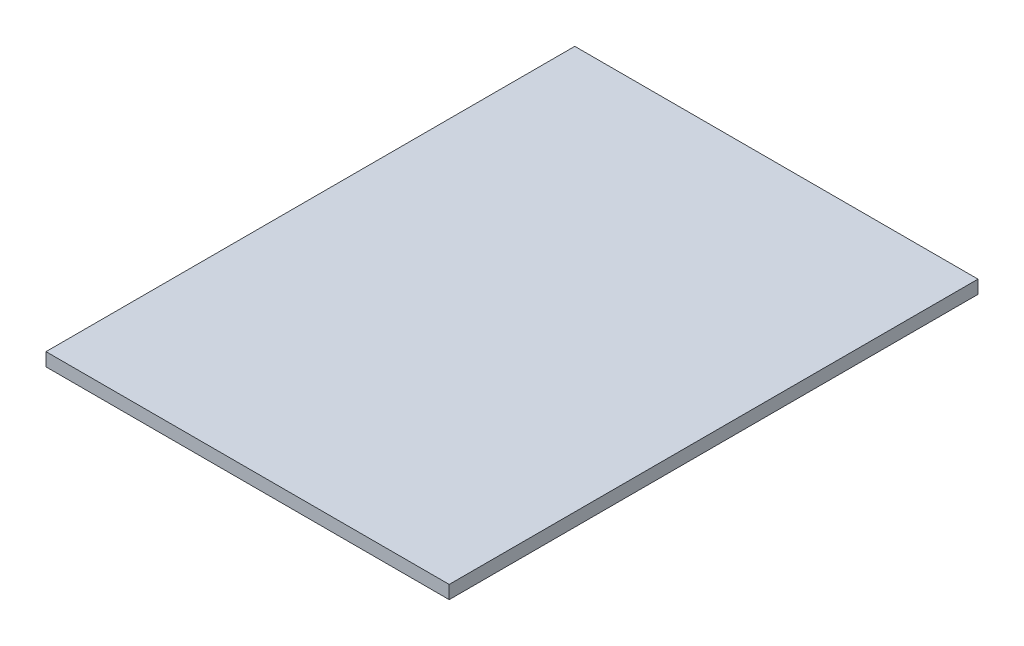
from build123d import *

# Parameters (mm, degrees)
SKIZZE1_W                       = 61
SKIZZE1_H                       = 80
AUFSATZ_LINEAR_AUSTRAGEN1_DEPTH = 2


with BuildPart() as part:
    # Skizze1 → Aufsatz-Linear austragen1 (new body)
    with BuildSketch(Plane(origin=(0, 0, 0), x_dir=(1, 0, 0), z_dir=(0, 1, 0))):
        Rectangle(SKIZZE1_W, SKIZZE1_H)
    extrude(amount=AUFSATZ_LINEAR_AUSTRAGEN1_DEPTH)


solid = part.part
